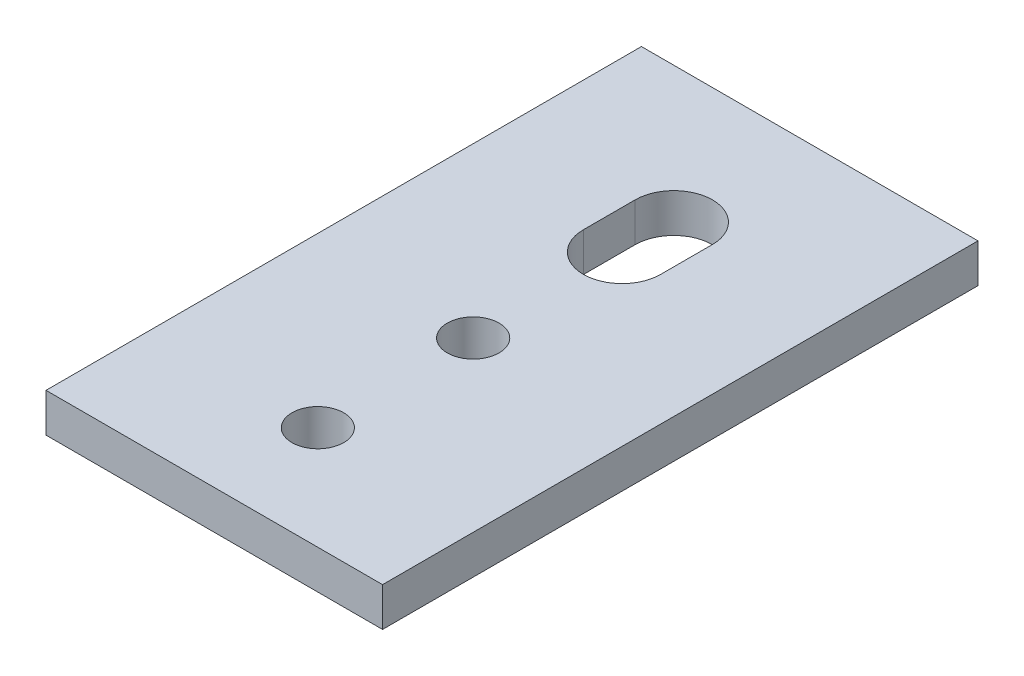
from build123d import *

# Parameters (mm, degrees)
SKETCH1_W           = 13
SKETCH1_H           = 23
SKETCH1_R           = 1
BOSS_EXTRUDE1_DEPTH = 1.5


with BuildPart() as part:
    # Sketch1 → Boss-Extrude1 (new body)
    with BuildSketch(Plane(origin=(0, 0, 0), x_dir=(1, 0, 0), z_dir=(0, 1, 0))):
        Rectangle(SKETCH1_W, SKETCH1_H)
        with Locations(Location((0, -1.5, 0), (0, 0, 270))):
            Circle(SKETCH1_R, mode=Mode.SUBTRACT)
        with Locations(Location((0, -7.5, 0), (0, 0, 270))):
            Circle(SKETCH1_R, mode=Mode.SUBTRACT)
        with BuildLine():
            Line((-1.493243243, 4.25), (-1.493243243, 6.25))
            ThreePointArc((-1.493243243, 6.25), (0, 7.743243243), (1.493243243, 6.25))
            Line((1.493243243, 6.25), (1.493243243, 4.25))
            ThreePointArc((1.493243243, 4.25), (0, 2.756756757), (-1.493243243, 4.25))
        make_face(mode=Mode.SUBTRACT)
    extrude(amount=BOSS_EXTRUDE1_DEPTH)


solid = part.part
